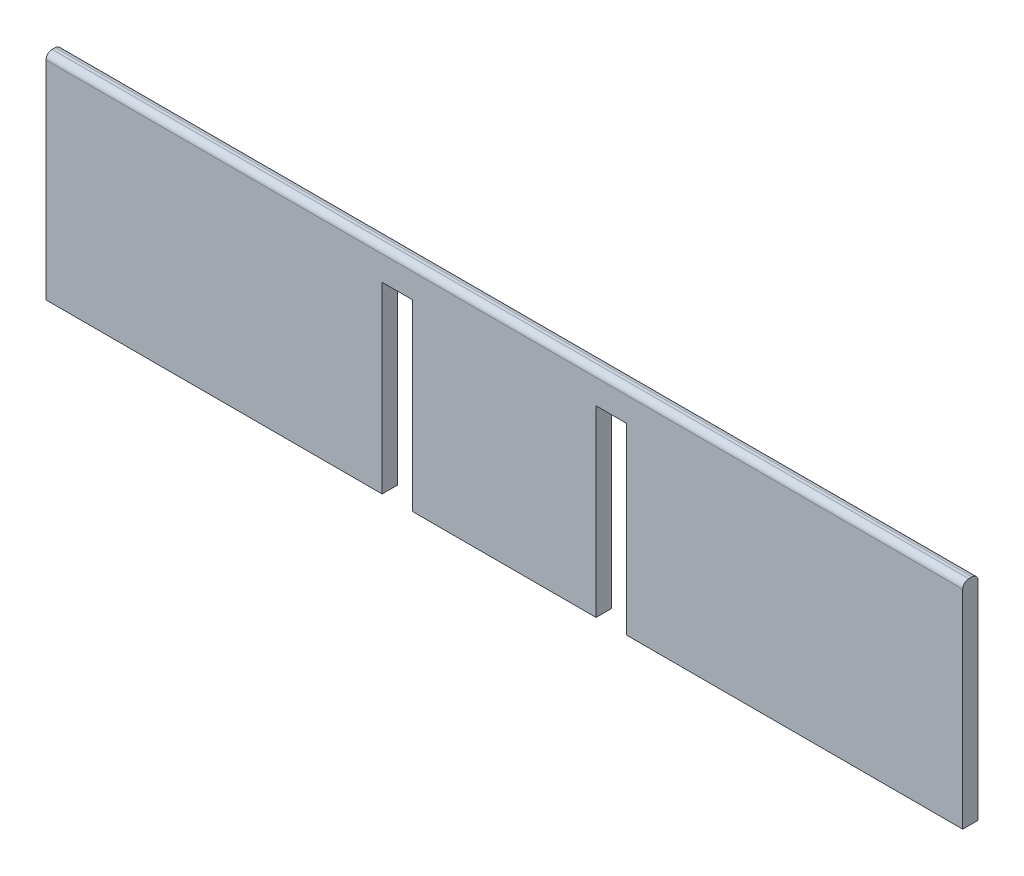
from build123d import *

# Parameters (mm, degrees)
ESQUISSE1_W             = 300
ESQUISSE1_H             = 70
BOSS_EXTRU_1_DEPTH      = 5
CONG_2_R                = 2
CONG_3_R                = 2
ESQUISSE2_W             = 10
ESQUISSE2_H             = 60
ENL_V_MAT_EXTRU_1_DEPTH = 155.110350074


with BuildPart() as part:
    # Esquisse1 → Boss.-Extru.1 (new body)
    with BuildSketch(Plane.XY):
        Rectangle(ESQUISSE1_W, ESQUISSE1_H)
    extrude(amount=BOSS_EXTRU_1_DEPTH)

    # Congé2
    cong_2_edges = [part.edges().sort_by_distance(p)[0] for p in [
        (0, 35, 0),
    ]]
    fillet(cong_2_edges, radius=CONG_2_R)

    # Congé3
    cong_3_edges = [part.edges().sort_by_distance(p)[0] for p in [
        (0, 35, 5),
    ]]
    fillet(cong_3_edges, radius=CONG_3_R)

    # Esquisse2 → Enlèv. mat.-Extru.1 (cut, through all)
    with BuildSketch(Plane(origin=(0, 0, 0), x_dir=(-1, 0, 0), z_dir=(0, 0, -1))):
        with Locations((-35, -5)):
            Rectangle(ESQUISSE2_W, ESQUISSE2_H)
        with Locations((35, -5)):
            Rectangle(ESQUISSE2_W, ESQUISSE2_H)
    extrude(amount=-ENL_V_MAT_EXTRU_1_DEPTH, mode=Mode.SUBTRACT)


solid = part.part
